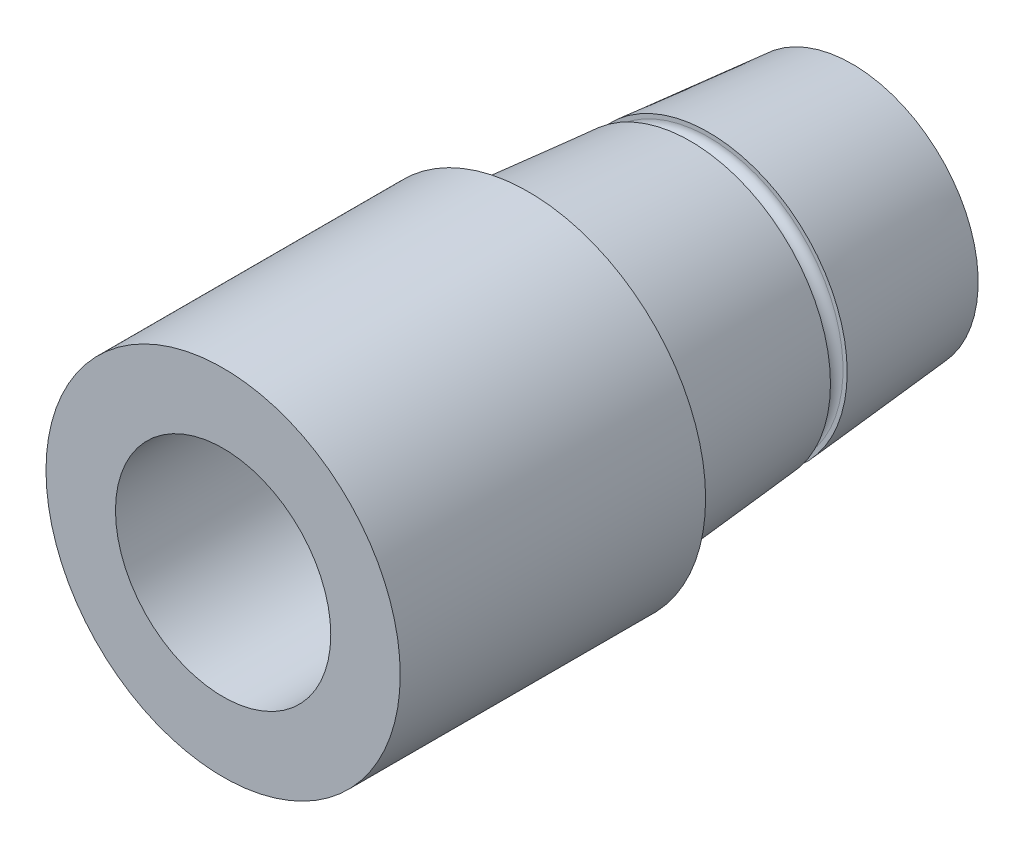
from build123d import *

# Parameters (mm, degrees)
SKETCH1_R           = 20.625566824
BOSS_EXTRUDE1_DEPTH = 53
BOSS_EXTRUDE1_DRAFT = 5
SKETCH2_R           = 17.625566824
CUT_EXTRUDE1_DEPTH  = 64.917011631
SKETCH_4_R          = 29
SKETCH_4_R_2        = 17.625566824
EXTRUDE_1_DEPTH     = 50


with BuildPart() as part:
    # Sketch1 → Boss-Extrude1 (with draft: the straight prism first)
    with BuildSketch(Plane(origin=(0, 0, -50), x_dir=(-1, 0, 0), z_dir=(0, 0, -1))):
        Circle(SKETCH1_R)
    extrude(amount=-BOSS_EXTRUDE1_DEPTH)
    # Boss-Extrude1: the draft: its side faces are tilted about the plane it starts from
    boss_extrude1_sides = [part.faces().sort_by_distance(p)[0] for p in [
        (20.625566824, 0, -23.5),
    ]]
    draft(boss_extrude1_sides, Plane(origin=(0, 0, -50), x_dir=(-1, 0, 0), z_dir=(0, 0, -1)), BOSS_EXTRUDE1_DRAFT)

    # Sketch2 → Cut-Extrude1 (cut, through all)
    with BuildSketch(Plane(origin=(0, 0, -50), x_dir=(-1, 0, 0), z_dir=(0, 0, -1))):
        Circle(SKETCH2_R)
    extrude(amount=-CUT_EXTRUDE1_DEPTH, mode=Mode.SUBTRACT)

    # Эскиз1 → Вырез-Повернуть1 (revolve, cut)
    with BuildSketch(Plane(origin=(0, 0, 0), x_dir=(0, 0, -1), z_dir=(1, 0, 0)), mode=Mode.PRIVATE) as cut_revolve_1_sk:
        with BuildLine():
            Line((26.5, 22), (26.5, 23.5))
            Line((26.5, 23.5), (23.5, 23.5))
            Line((23.5, 23.5), (23.5, 22))
            ThreePointArc((23.5, 22), (25, 20.5), (26.5, 22))
        make_face()
    revolve(cut_revolve_1_sk.sketch.rotate(Axis((0, 0, -8.98762519), (0, 0, 1)), 90), axis=Axis((0, 0, -8.98762519), (0, 0, 1)), mode=Mode.SUBTRACT)

    # Эскиз4 → Бобышка-Вытянуть1 (add)
    with BuildSketch(Plane.XY.offset(3)):
        Circle(SKETCH_4_R)
        with Locations(Location((0, 0, 0), (0, 0, 180))):
            Circle(SKETCH_4_R_2, mode=Mode.SUBTRACT)
    extrude(amount=EXTRUDE_1_DEPTH)


solid = part.part
